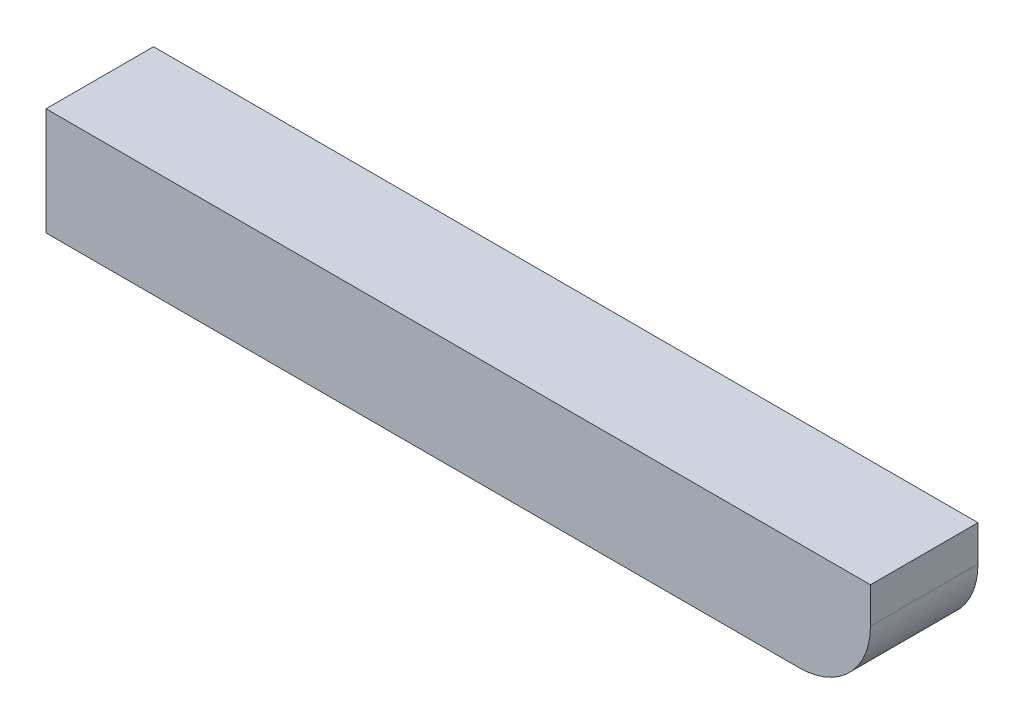
from build123d import *

# Parameters (mm, degrees)
SCHIZZO1_W                   = 115
SCHIZZO1_H                   = 15
ESTRUSIONE_ESTRUSIONE1_DEPTH = 15
RACCORDO5_R                  = 10


with BuildPart() as part:
    # Schizzo1 → Estrusione-Estrusione1 (new body)
    with BuildSketch(Plane.XY):
        with Locations((19.33351469, 3.808487486)):
            Rectangle(SCHIZZO1_W, SCHIZZO1_H)
    extrude(amount=ESTRUSIONE_ESTRUSIONE1_DEPTH)

    # Raccordo5
    raccordo5_edges = [part.edges().sort_by_distance(p)[0] for p in [
        (76.83351469, -3.691512514, 7.5),
    ]]
    fillet(raccordo5_edges, radius=RACCORDO5_R)


solid = part.part
